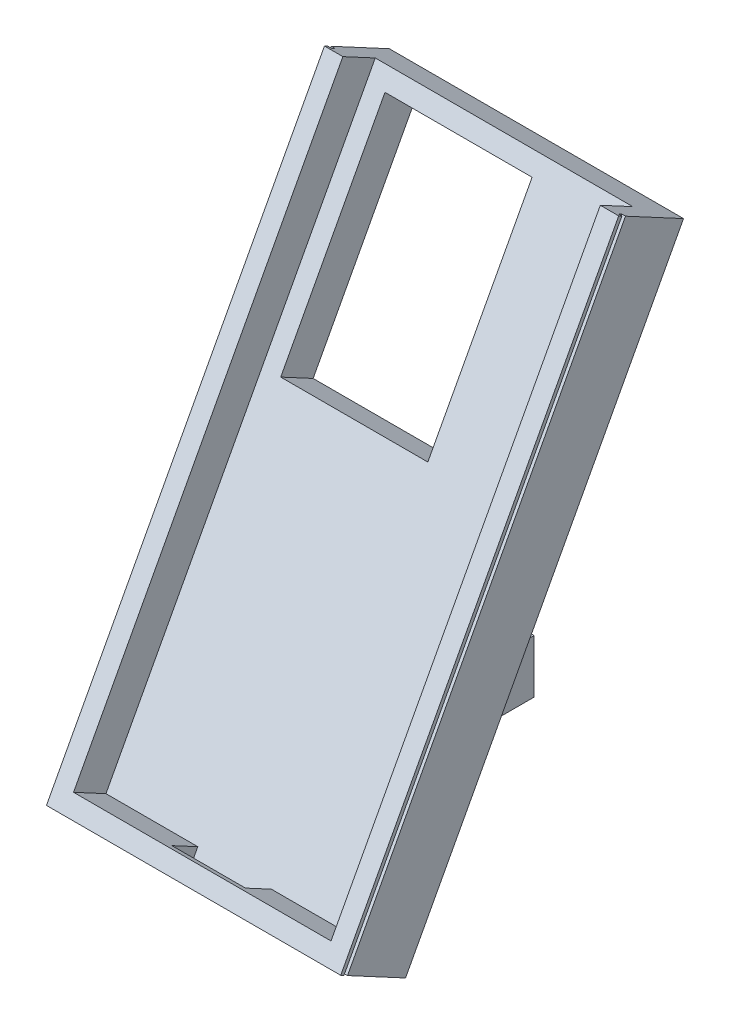
from build123d import *

# Parameters (mm, degrees)
SKETCH_1_W               = 39.5
SKETCH_1_H               = 14.5
EXTRUDE_1_DEPTH          = 40
SKETCH_6_W               = 80
SKETCH_6_H               = 160
EXTRUDE_2_DEPTH          = 10
EXTRUDE_3_DEPTH          = 10
SKETCH_8_W               = 40
SKETCH_8_H               = 60
CUT_EXTRUDE_1_DEPTH      = 10
SKETCH_9_W               = 20
SKETCH_9_H               = 8
CUT_EXTRUDE_3_DEPTH      = 10
CUT_EXTRUDE_4_DEPTH      = 158.764612799
CUT_EXTRUDE_4_DEPTH_BACK = 1
CUT_EXTRUDE_5_DEPTH      = 1


with BuildPart() as part:
    # 草图1 → 凸台-拉伸1 (new body)
    with BuildSketch(Plane.XY):
        Rectangle(SKETCH_1_W, SKETCH_1_H)
    extrude(amount=EXTRUDE_1_DEPTH)

    # 草图6 → 凸台-拉伸2 (add)
    with BuildSketch(Plane(origin=(0, 15.03668382, 28.054947672), x_dir=(1, 0, 0), z_dir=(0, 0.4723983215829414, 0.8813851744643881))):
        with Locations((0, 22.485349826)):
            Rectangle(SKETCH_6_W, SKETCH_6_H)
    extrude(amount=EXTRUDE_2_DEPTH)

    # 草图7 → 凸台-拉伸3 (add)
    with BuildSketch(Plane(origin=(0, 19.760667036, 36.868799416), x_dir=(1, 0, 0), z_dir=(0, 0.4723983215829416, 0.881385174464388))):
        Polygon((-35, -52.514650174), (35, -52.514650174), (35, 102.485349826), (40, 102.485349826), (40, -57.514650174), (-40, -57.514650174), (-40, 102.485349826), (-35, 102.485349826), align=None)
    extrude(amount=EXTRUDE_3_DEPTH)

    # 草图8 → 切除-拉伸1 (cut)
    with BuildSketch(Plane(origin=(0, 19.760667036, 36.868799416), x_dir=(1, 0, 0), z_dir=(0, 0.47239832158294137, 0.8813851744643881))):
        with Locations((-10, 67.485349826)):
            Rectangle(SKETCH_8_W, SKETCH_8_H)
    extrude(amount=-CUT_EXTRUDE_1_DEPTH, mode=Mode.SUBTRACT)

    # 草图9 → 切除-拉伸3 (cut)
    with BuildSketch(Plane(origin=(0, -50.692559978, 27.169824208), x_dir=(1, 0, 0), z_dir=(0, -0.881385174464388, 0.47239832158294154))):
        with Locations((-0.027304515, 45.830519147)):
            Rectangle(SKETCH_9_W, SKETCH_9_H)
    extrude(amount=-CUT_EXTRUDE_3_DEPTH, mode=Mode.SUBTRACT)

    # 草图10 → 切除-拉伸4 (cut, two sides: drawn at the far end of the back side and taken through both)
    with BuildSketch(Plane.ZY.offset(40).offset(-CUT_EXTRUDE_4_DEPTH_BACK)):
        Polygon((235.352563611, -333.840604393), (71.001566503, -27.199946201), (-4.58216495, 113.821681713), (-3.612641258, 114.341319867), (71.971090195, -26.680308047), (236.322087302, -333.320966239), (565.024081517, -946.602282623), (564.054557825, -947.121920777), align=None)
    extrude(amount=CUT_EXTRUDE_4_DEPTH + CUT_EXTRUDE_4_DEPTH_BACK, mode=Mode.SUBTRACT)

    # 草图11 → 切除-拉伸5 (cut)
    with BuildSketch(Plane(origin=(40, 0, 0), x_dir=(0, 0, -1), z_dir=(1, 0, 0))):
        Polygon((3.612641258, 114.341319867), (-71.971090195, -26.680308047), (-71.001566503, -27.199946201), (4.58216495, 113.821681713), align=None)
    extrude(amount=-CUT_EXTRUDE_5_DEPTH, mode=Mode.SUBTRACT)


solid = part.part
